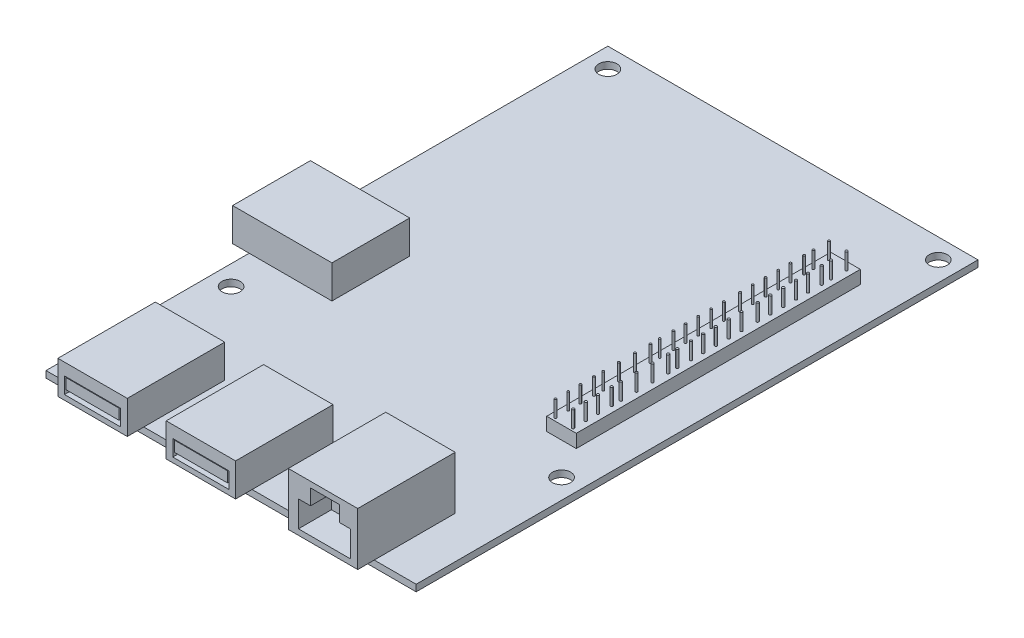
from build123d import *

# Parameters (mm, degrees)
SKETCH1_W           = 56
SKETCH1_H           = 85
BOSS_EXTRUDE2_DEPTH = 1
SKETCH2_R           = 1.375
CUT_EXTRUDE1_DEPTH  = 2
SKETCH3_W           = 10.5
SKETCH3_H           = 14.7412865
BOSS_EXTRUDE3_DEPTH = 5
SKETCH5_W           = 10.5
SKETCH5_H           = 14.7412865
BOSS_EXTRUDE4_DEPTH = 3
CUT_EXTRUDE3_DEPTH  = 5
SKETCH7_W           = 15.02443759
SKETCH7_H           = 11.765446253
BOSS_EXTRUDE5_DEPTH = 5
SKETCH8_W           = 4.473595772
SKETCH8_H           = 42.973632112
BOSS_EXTRUDE6_DEPTH = 2
SKETCH9_R           = 0.150692164
SKETCH9_R_2         = 0.177318989
BOSS_EXTRUDE7_DEPTH = 2.5
SKETCH10_W          = 8.5
SKETCH10_H          = 2.441134092
SKETCH10_W_2        = 8
SKETCH10_H_2        = 1.591134092
CUT_EXTRUDE4_DEPTH  = 10


with BuildPart() as part:
    # Sketch1 → Boss-Extrude2 (new body)
    with BuildSketch(Plane(origin=(0, 0, 0), x_dir=(1, 0, 0), z_dir=(0, 1, 0))):
        Rectangle(SKETCH1_W, SKETCH1_H)
    extrude(amount=BOSS_EXTRUDE2_DEPTH)

    # Sketch2 → Cut-Extrude1 (cut)
    with BuildSketch(Plane(origin=(0, 1, 0), x_dir=(1, 0, 0), z_dir=(0, 1, 0))):
        with Locations((-25, 39.5)):
            Circle(SKETCH2_R)
        with Locations((-25, -17.5)):
            Circle(SKETCH2_R)
        with Locations((25, -17.5)):
            Circle(SKETCH2_R)
        with Locations((25, 39.5)):
            Circle(SKETCH2_R)
    extrude(amount=-CUT_EXTRUDE1_DEPTH, mode=Mode.SUBTRACT)

    # Sketch3 → Boss-Extrude3 (add)
    with BuildSketch(Plane(origin=(0, 1, 0), x_dir=(1, 0, 0), z_dir=(0, 1, 0))):
        with Locations((-18.452622363, -37.62935675)):
            Rectangle(SKETCH3_W, SKETCH3_H)
        with Locations((-2.068345025, -37.62935675)):
            Rectangle(SKETCH3_W, SKETCH3_H)
        with Locations((16.410163251, -37.62935675)):
            Rectangle(SKETCH3_W, SKETCH3_H)
    extrude(amount=BOSS_EXTRUDE3_DEPTH)

    # Sketch5 → Boss-Extrude4 (add)
    with BuildSketch(Plane(origin=(0, 6, 0), x_dir=(1, 0, 0), z_dir=(0, 1, 0))):
        with Locations((16.410163251, -37.62935675)):
            Rectangle(SKETCH5_W, SKETCH5_H)
    extrude(amount=BOSS_EXTRUDE4_DEPTH)

    # Sketch6 → Cut-Extrude3 (cut)
    with BuildSketch(Plane.XY.offset(45)):
        Polygon((18.904475678, 5.77941685), (20.539810944, 5.77941685), (20.539810944, 1.854612211), (12.690201666, 1.854612211), (12.690201666, 5.77941685), (14.521777165, 5.77941685), (14.521777165, 8.134299634), (18.904475678, 8.134299634), align=None)
    extrude(amount=-CUT_EXTRUDE3_DEPTH, mode=Mode.SUBTRACT)

    # Sketch7 → Boss-Extrude5 (add)
    with BuildSketch(Plane(origin=(0, 1, 0), x_dir=(1, 0, 0), z_dir=(0, 1, 0))):
        with Locations((-22.987781205, -5.882723127)):
            Rectangle(SKETCH7_W, SKETCH7_H)
    extrude(amount=BOSS_EXTRUDE5_DEPTH)

    # Sketch8 → Boss-Extrude6 (add)
    with BuildSketch(Plane(origin=(0, 1, 0), x_dir=(1, 0, 0), z_dir=(0, 1, 0))):
        with Locations((20.101252547, 8.8708907)):
            Rectangle(SKETCH8_W, SKETCH8_H)
    extrude(amount=BOSS_EXTRUDE6_DEPTH)

    # Sketch9 → Boss-Extrude7 (add)
    with BuildSketch(Plane(origin=(0, 3, 0), x_dir=(1, 0, 0), z_dir=(0, 1, 0))):
        with Locations((18.731333841, 29.224207716)):
            Circle(SKETCH9_R)
        with Locations((21.39111867, 29.224207716)):
            Circle(SKETCH9_R_2)
        with Locations((21.39111867, 26.863865293)):
            Circle(SKETCH9_R_2)
        with Locations((18.731333841, 26.863865293)):
            Circle(SKETCH9_R)
        with Locations((21.39111867, 19.643989812)):
            Circle(SKETCH9_R_2)
        with Locations((18.731333841, 19.643989812)):
            Circle(SKETCH9_R)
        with Locations((18.731333841, 25.466925578)):
            Circle(SKETCH9_R)
        with Locations((21.39111867, 25.466925578)):
            Circle(SKETCH9_R_2)
        with Locations((21.39111867, 23.40127195)):
            Circle(SKETCH9_R_2)
        with Locations((18.731333841, 23.40127195)):
            Circle(SKETCH9_R)
        with Locations((21.39111867, 21.562299043)):
            Circle(SKETCH9_R_2)
        with Locations((18.731333841, 21.562299043)):
            Circle(SKETCH9_R)
        with Locations((21.39111867, 17.692041416)):
            Circle(SKETCH9_R_2)
        with Locations((18.731333841, 17.692041416)):
            Circle(SKETCH9_R)
        with Locations((21.39111867, 15.773732186)):
            Circle(SKETCH9_R_2)
        with Locations((18.731333841, 15.773732186)):
            Circle(SKETCH9_R)
        with Locations((18.731333841, 13.322310221)):
            Circle(SKETCH9_R)
        with Locations((21.39111867, 13.322310221)):
            Circle(SKETCH9_R_2)
        with Locations((18.731333841, 11.404000991)):
            Circle(SKETCH9_R)
        with Locations((21.39111867, 11.404000991)):
            Circle(SKETCH9_R_2)
        with Locations((18.731333841, 7.533743365)):
            Circle(SKETCH9_R)
        with Locations((21.39111867, 7.533743365)):
            Circle(SKETCH9_R_2)
        with Locations((18.731333841, 5.694770457)):
            Circle(SKETCH9_R)
        with Locations((21.39111867, 5.694770457)):
            Circle(SKETCH9_R_2)
        with Locations((21.39111867, 3.62911683)):
            Circle(SKETCH9_R_2)
        with Locations((18.731333841, 3.62911683)):
            Circle(SKETCH9_R)
        with Locations((18.731333841, 9.452052595)):
            Circle(SKETCH9_R)
        with Locations((21.39111867, 9.452052595)):
            Circle(SKETCH9_R_2)
        with Locations((18.731333841, 2.232177114)):
            Circle(SKETCH9_R)
        with Locations((21.39111867, 2.232177114)):
            Circle(SKETCH9_R_2)
        with Locations((21.39111867, -0.128165309)):
            Circle(SKETCH9_R_2)
        with Locations((18.731333841, -0.128165309)):
            Circle(SKETCH9_R)
        with Locations((21.39111867, -12.145292971)):
            Circle(SKETCH9_R_2)
        with Locations((18.731333841, -12.145292971)):
            Circle(SKETCH9_R)
        with Locations((18.731333841, -2.565075067)):
            Circle(SKETCH9_R)
        with Locations((21.39111867, -2.565075067)):
            Circle(SKETCH9_R_2)
        with Locations((21.39111867, -4.92541749)):
            Circle(SKETCH9_R_2)
        with Locations((18.731333841, -4.92541749)):
            Circle(SKETCH9_R)
        with Locations((18.731333841, -6.322357206)):
            Circle(SKETCH9_R)
        with Locations((21.39111867, -6.322357206)):
            Circle(SKETCH9_R_2)
        with Locations((21.39111867, -8.388010833)):
            Circle(SKETCH9_R_2)
        with Locations((18.731333841, -8.388010833)):
            Circle(SKETCH9_R)
        with Locations((21.39111867, -10.226983741)):
            Circle(SKETCH9_R_2)
        with Locations((18.731333841, -10.226983741)):
            Circle(SKETCH9_R)
    extrude(amount=BOSS_EXTRUDE7_DEPTH)

    # Sketch10 → Cut-Extrude4 (cut)
    # profile 1 of 2: a face of its own
    with BuildSketch(Plane.XY.offset(45)):
        with Locations((-18.452622363, 2.970567046)):
            Rectangle(SKETCH10_W, SKETCH10_H)
        with Locations((-18.452622363, 3.295567046)):
            Rectangle(SKETCH10_W_2, SKETCH10_H_2, mode=Mode.SUBTRACT)
    # profile 2 of 2: a face of its own
    with BuildSketch(Plane.XY.offset(45)):
        with Locations((-2.068345025, 2.970567046)):
            Rectangle(SKETCH10_W, SKETCH10_H)
        with Locations((-2.068345025, 3.295567046)):
            Rectangle(SKETCH10_W_2, SKETCH10_H_2, mode=Mode.SUBTRACT)
    extrude(amount=-CUT_EXTRUDE4_DEPTH, mode=Mode.SUBTRACT)


solid = part.part
